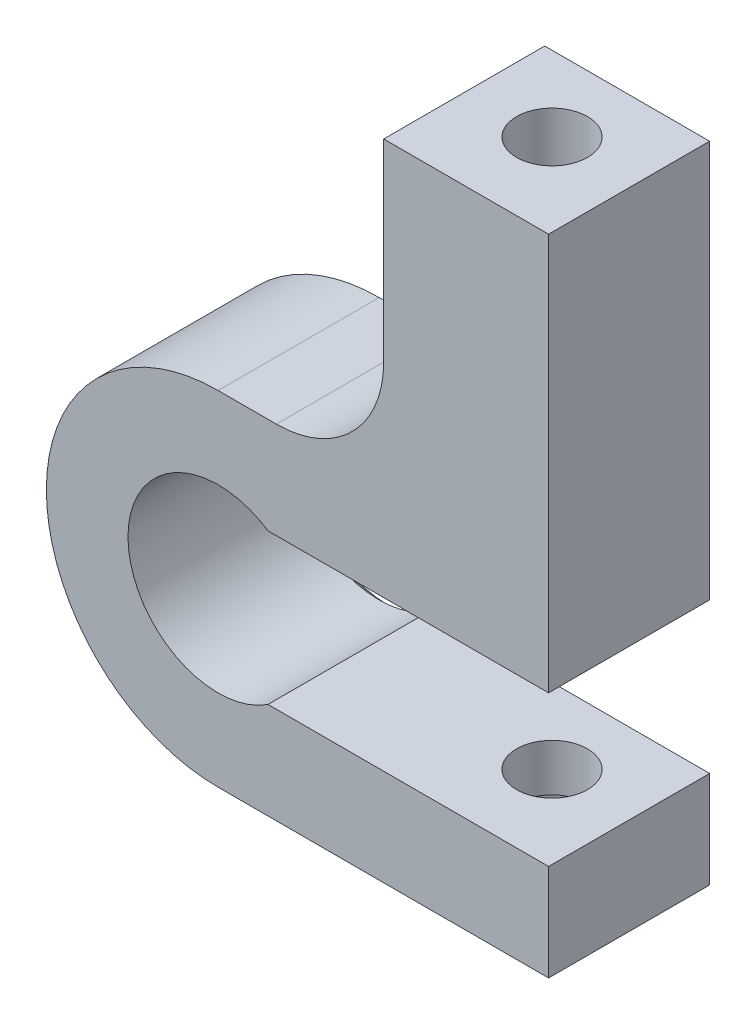
from build123d import *

# Parameters (mm, degrees)
BOSS_EXTRUDE1_DEPTH = 8
SKETCH2_R           = 1.65
CUT_EXTRUDE1_DEPTH  = 24.597050759
SKETCH3_R           = 3
CUT_EXTRUDE2_DEPTH  = 2.3
SKETCH4_W           = 7.68
SKETCH4_H           = 8
SKETCH4_R           = 1.65
BOSS_EXTRUDE2_DEPTH = 18.5
FILLET1_R           = 5
CHAMFER1_SIZE       = 0.5


with BuildPart() as part:
    # Sketch1 → Boss-Extrude1 (new body)
    with BuildSketch(Plane.XY):
        with BuildLine():
            Line((0, 8), (15.38898322, 8))
            Line((15.38898322, 8), (15.38898322, 3.5))
            Line((15.38898322, 3.5), (2.321637353, 3.5))
            ThreePointArc((2.321637353, 3.5), (-4.2, 0), (2.321637353, -3.5))
            Line((2.321637353, -3.5), (15.38898322, -3.5))
            Line((15.38898322, -3.5), (15.38898322, -8))
            Line((15.38898322, -8), (0, -8))
            ThreePointArc((0, -8), (-8, 0), (0, 8))
        make_face()
    extrude(amount=BOSS_EXTRUDE1_DEPTH)

    # Sketch2 → Cut-Extrude1 (cut, through all)
    with BuildSketch(Plane.XZ.offset(8)):
        with Locations(Location((11.54898322, 4, 0), (0, 0, 270))):
            Circle(SKETCH2_R)
    extrude(amount=-CUT_EXTRUDE1_DEPTH, mode=Mode.SUBTRACT)

    # Sketch3 → Cut-Extrude2 (cut)
    with BuildSketch(Plane.XZ.offset(8)):
        with Locations(Location((11.54898322, 4, 0), (0, 0, 270))):
            Circle(SKETCH3_R)
    extrude(amount=-CUT_EXTRUDE2_DEPTH, mode=Mode.SUBTRACT)

    # Sketch4 → Boss-Extrude2 (add)
    with BuildSketch(Plane.XZ.offset(-3.5)):
        with Locations((11.54898322, 4)):
            Rectangle(SKETCH4_W, SKETCH4_H)
        with Locations(Location((11.54898322, 4, 0), (0, 0, 270))):
            Circle(SKETCH4_R, mode=Mode.SUBTRACT)
    extrude(amount=-BOSS_EXTRUDE2_DEPTH)

    # Fillet1
    fillet1_edges = [part.edges().sort_by_distance(p)[0] for p in [
        (7.70898322, 8, 4),
    ]]
    fillet(fillet1_edges, radius=FILLET1_R)

    # Chamfer1
    chamfer1_edges = [part.edges().sort_by_distance(p)[0] for p in [
        (8.855310287, 3.5, 0),
        (-4.2, 0, 0),
        (11.54898322, 22, 0),
        (7.70898322, 17.5, 0),
        (1.35449161, 8, 0),
        (6.244517126, 9.464466094, 0),
        (8.855310287, -3.5, 0),
        (15.38898322, -5.75, 0),
        (7.69449161, -8, 0),
        (-8, 0, 0),
        (15.38898322, 12.75, 0),
    ]]
    chamfer(chamfer1_edges, length=CHAMFER1_SIZE)


solid = part.part
